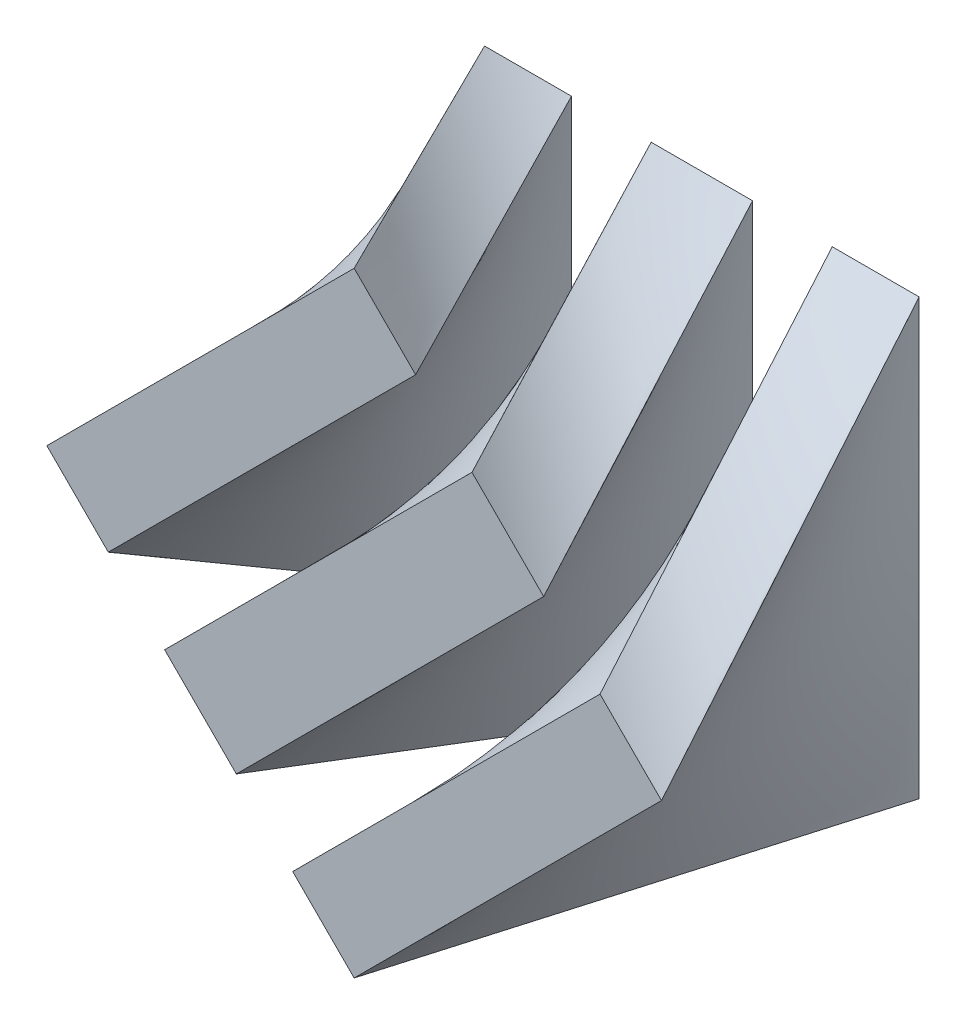
from build123d import *


with BuildPart() as part:
    # Sketch2 → Loft5 section 0
    with BuildSketch(Plane.XY.offset(12)):
        with BuildLine():
            Line((-3.106601718, 0), (7.5, 10.606601718))
            Line((7.5, 10.606601718), (9.621320344, 8.485281374))
            Line((9.621320344, 8.485281374), (-0.985281374, -2.121320344))
            Line((-0.985281374, -2.121320344), (-3.106601718, 0))
        make_face()
    # Sketch1 → Loft5 section 1
    with BuildSketch(Plane.XY):
        with BuildLine():
            Line((0, -7.5), (3, -7.5))
            Line((3, -7.5), (3, 7.5))
            Line((3, 7.5), (0, 7.5))
            Line((0, 7.5), (0, -7.5))
        make_face()
    loft()


with BuildPart() as body_2:
    # Sketch5 → Loft6 section 0
    with BuildSketch(Plane.XY.offset(12)):
        with BuildLine():
            Line((0.959262274, -4.065863992), (11.565863992, 6.540737726))
            Line((11.565863992, 6.540737726), (14.040737726, 4.065863992))
            Line((14.040737726, 4.065863992), (3.434136008, -6.540737726))
            Line((3.434136008, -6.540737726), (0.959262274, -4.065863992))
        make_face()
    # Sketch3 → Loft6 section 1
    with BuildSketch(Plane.XY):
        with BuildLine():
            Line((5.75, -7.5), (9.25, -7.5))
            Line((9.25, -7.5), (9.25, 7.5))
            Line((9.25, 7.5), (5.75, 7.5))
            Line((5.75, 7.5), (5.75, -7.5))
        make_face()
    loft()


with BuildPart() as body_3:
    # Sketch6 → Loft7 section 0
    with BuildSketch(Plane.XY.offset(12)):
        with BuildLine():
            Line((5.378679656, -8.485281374), (15.985281374, 2.121320344))
            Line((15.985281374, 2.121320344), (18.106601718, 0))
            Line((18.106601718, 0), (7.5, -10.606601718))
            Line((7.5, -10.606601718), (5.378679656, -8.485281374))
        make_face()
    # Sketch4 → Loft7 section 1
    with BuildSketch(Plane.XY):
        with BuildLine():
            Line((12, -7.5), (15, -7.5))
            Line((15, -7.5), (15, 7.5))
            Line((15, 7.5), (12, 7.5))
            Line((12, 7.5), (12, -7.5))
        make_face()
    loft()


solid = Compound([part.part, body_2.part, body_3.part])
